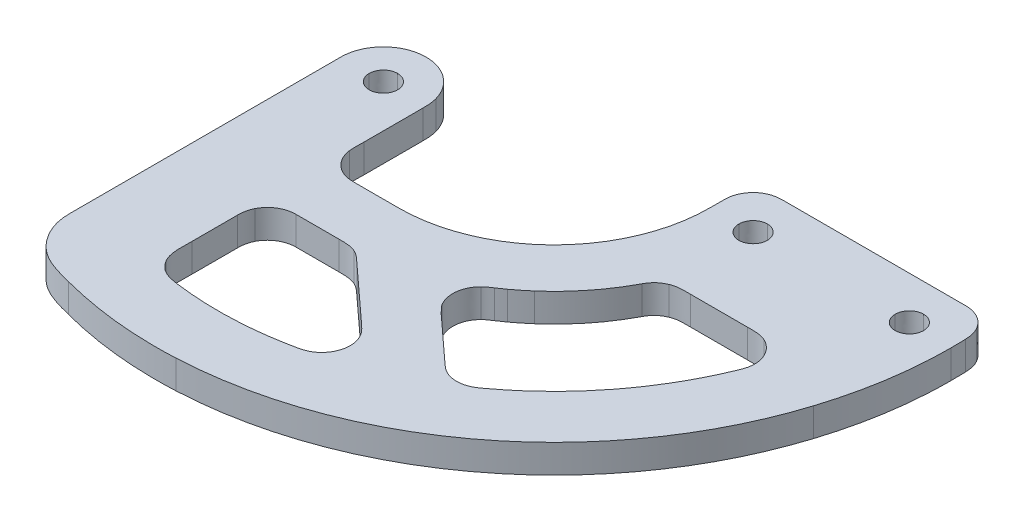
from build123d import *

# Parameters (mm, degrees)
BOSS_EXTRUDE1_DEPTH = 6.35


with BuildPart() as part:
    # Imported Profile → Boss-Extrude1 (new body)
    with BuildSketch(Plane(origin=(0, 0, 0), x_dir=(1, 0, 0), z_dir=(0, 1, 0))):
        with BuildLine():
            add(Edge.make_bspline(
                [(0.2385822, 77.0120888), (0.1971548, 76.9636002), (0.2384552, 77.0755888), (0.2384552, 77.1101074)],
                knots=[0, 0, 0, 0, 1, 1, 1, 1], degree=3))
            add(Edge.make_bspline(
                [(0.2384552, 77.1101074), (0.2384552, 77.1451086), (0.2384552, 77.1721088), (0.2384552, 77.206602)],
                knots=[0, 0, 0, 0, 1, 1, 1, 1], degree=3))
            add(Edge.make_bspline(
                [(0.2384552, 77.206602), (0.2384552, 77.2686034), (0.2384552, 77.3375898), (0.245491, 77.3995912)],
                knots=[0, 0, 0, 0, 1, 1, 1, 1], degree=3))
            add(Edge.make_bspline(
                [(0.245491, 77.3995912), (0.245491, 77.5306044), (0.259588, 77.6615922), (0.2661412, 77.7926054)],
                knots=[0, 0, 0, 0, 1, 1, 1, 1], degree=3))
            add(Edge.make_bspline(
                [(0.2661412, 77.7926054), (0.2936494, 78.0611088), (0.321183, 78.3231352), (0.3695192, 78.5850092)],
                knots=[0, 0, 0, 0, 1, 1, 1, 1], degree=3))
            add(Edge.make_bspline(
                [(0.3695192, 78.5850092), (0.459105, 79.1361892), (0.5969, 79.6736024), (0.7829296, 80.1972996)],
                knots=[0, 0, 0, 0, 1, 1, 1, 1], degree=3))
            add(Edge.make_bspline(
                [(0.7829296, 80.1972996), (1.1894566, 81.3341528), (1.7475454, 82.305652), (2.5330404, 83.2152006)],
                knots=[0, 0, 0, 0, 1, 1, 1, 1], degree=3))
            add(Edge.make_bspline(
                [(2.5330404, 83.2152006), (4.0557704, 84.992845), (6.1779404, 86.1434904), (8.4930488, 86.4535482)],
                knots=[0, 0, 0, 0, 1, 1, 1, 1], degree=3))
            add(Edge.make_bspline(
                [(8.4930488, 86.4535482), (13.2059426, 87.087456), (17.6501298, 84.1660496), (18.9316868, 79.584042)],
                knots=[0, 0, 0, 0, 1, 1, 1, 1], degree=3))
            add(Edge.make_bspline(
                [(18.9316868, 79.584042), (19.2279778, 78.5298404), (19.2899792, 77.4756388), (19.2899792, 76.3869948)],
                knots=[0, 0, 0, 0, 1, 1, 1, 1], degree=3))
            add(Edge.make_bspline(
                [(19.2899792, 76.3869948), (19.2899792, 75.2845586), (19.2899792, 74.1821478), (19.2899792, 73.0796862)],
                knots=[0, 0, 0, 0, 1, 1, 1, 1], degree=3))
            add(Edge.make_bspline(
                [(19.2899792, 73.0796862), (19.2899792, 70.8748392), (19.2899792, 68.6631088), (19.2899792, 66.4582364)],
                knots=[0, 0, 0, 0, 1, 1, 1, 1], degree=3))
            add(Edge.make_bspline(
                [(19.2899792, 66.4582364), (19.2899792, 65.3558002), (19.2899792, 64.2533894), (19.2899792, 63.1509532)],
                knots=[0, 0, 0, 0, 1, 1, 1, 1], degree=3))
            add(Edge.make_bspline(
                [(19.2899792, 63.1509532), (19.2899792, 62.0623092), (19.2003934, 60.9736398), (19.3312796, 59.8849958)],
                knots=[0, 0, 0, 0, 1, 1, 1, 1], degree=3))
            add(Edge.make_bspline(
                [(19.3312796, 59.8849958), (19.600037, 57.5216528), (21.1709762, 55.5096934), (23.3964988, 54.6691058)],
                knots=[0, 0, 0, 0, 1, 1, 1, 1], degree=3))
            add(Edge.make_bspline(
                [(23.3964988, 54.6691058), (24.4575838, 54.2695892), (25.4980186, 54.2626042), (26.593546, 54.2626042)],
                knots=[0, 0, 0, 0, 1, 1, 1, 1], degree=3))
            add(Edge.make_bspline(
                [(26.593546, 54.2626042), (27.6890988, 54.2626042), (28.7846516, 54.2626042), (29.880179, 54.2626042)],
                knots=[0, 0, 0, 0, 1, 1, 1, 1], degree=3))
            add(Edge.make_bspline(
                [(29.880179, 54.2626042), (32.0505836, 54.2626042), (34.2210136, 54.227603), (36.3914182, 54.267608)],
                knots=[0, 0, 0, 0, 1, 1, 1, 1], degree=3))
            add(Edge.make_bspline(
                [(36.3914182, 54.267608), (40.8493722, 54.3501072), (44.9352416, 55.197756), (49.0555788, 56.8927488)],
                knots=[0, 0, 0, 0, 1, 1, 1, 1], degree=3))
            add(Edge.make_bspline(
                [(49.0555788, 56.8927488), (57.8198996, 60.5032572), (64.7376658, 67.5174418), (68.2309786, 76.336906)],
                knots=[0, 0, 0, 0, 1, 1, 1, 1], degree=3))
            add(Edge.make_bspline(
                [(68.2309786, 76.336906), (69.9052958, 80.5743372), (70.6769986, 84.7567012), (70.6769986, 89.3180078)],
                knots=[0, 0, 0, 0, 1, 1, 1, 1], degree=3))
            add(Edge.make_bspline(
                [(70.6769986, 89.3180078), (70.6769986, 90.4341854), (70.635495, 91.5503884), (70.690994, 92.6666422)],
                knots=[0, 0, 0, 0, 1, 1, 1, 1], degree=3))
            add(Edge.make_bspline(
                [(70.690994, 92.6666422), (70.7460612, 93.879289), (71.0768454, 94.878398), (71.752079, 95.8843396)],
                knots=[0, 0, 0, 0, 1, 1, 1, 1], degree=3))
            add(Edge.make_bspline(
                [(71.752079, 95.8843396), (72.4617804, 96.9523588), (73.3092768, 97.6620094), (74.4875066, 98.1787978)],
                knots=[0, 0, 0, 0, 1, 1, 1, 1], degree=3))
            add(Edge.make_bspline(
                [(74.4875066, 98.1787978), (75.5623584, 98.6473008), (76.6234434, 98.7093022), (77.760322, 98.7093022)],
                knots=[0, 0, 0, 0, 1, 1, 1, 1], degree=3))
            add(Edge.make_bspline(
                [(77.760322, 98.7093022), (86.7520236, 98.7093022), (95.7506086, 98.7093022), (104.7423356, 98.7093022)],
                knots=[0, 0, 0, 0, 1, 1, 1, 1], degree=3))
            add(Edge.make_bspline(
                [(104.7423356, 98.7093022), (109.2140564, 98.7093022), (113.6858026, 98.7093022), (118.1575234, 98.7093022)],
                knots=[0, 0, 0, 0, 1, 1, 1, 1], degree=3))
            add(Edge.make_bspline(
                [(118.1575234, 98.7093022), (120.569101, 98.7093022), (122.7119466, 97.54489), (123.8763842, 95.4020444)],
                knots=[0, 0, 0, 0, 1, 1, 1, 1], degree=3))
            add(Edge.make_bspline(
                [(123.8763842, 95.4020444), (124.4413818, 94.368493), (124.620528, 93.3418504), (124.6618792, 92.1980884)],
                knots=[0, 0, 0, 0, 1, 1, 1, 1], degree=3))
            add(Edge.make_bspline(
                [(124.6618792, 92.1980884), (124.6963724, 91.1025356), (124.716921, 90.0138916), (124.7098598, 88.9183388)],
                knots=[0, 0, 0, 0, 1, 1, 1, 1], degree=3))
            add(Edge.make_bspline(
                [(124.7098598, 88.9183388), (124.689362, 79.747491), (123.3318336, 71.0865482), (120.5688724, 62.342903)],
                knots=[0, 0, 0, 0, 1, 1, 1, 1], degree=3))
            add(Edge.make_bspline(
                [(120.5688724, 62.342903), (109.3447394, 26.8722094), (77.2295636, 2.136394), (40.077644, 0.3311398)],
                knots=[0, 0, 0, 0, 1, 1, 1, 1], degree=3))
            add(Edge.make_bspline(
                [(40.077644, 0.3311398), (30.913705, -0.1168654), (22.1907354, 0.7926578), (13.3161532, 3.1010352)],
                knots=[0, 0, 0, 0, 1, 1, 1, 1], degree=3))
            add(Edge.make_bspline(
                [(13.3161532, 3.1010352), (8.7686134, 4.2861484), (4.8549814, 5.2783486), (2.0920456, 9.8120962)],
                knots=[0, 0, 0, 0, 1, 1, 1, 1], degree=3))
            add(Edge.make_bspline(
                [(2.0920456, 9.8120962), (0.8449056, 11.8515384), (0.2661412, 13.8634978), (0.2385822, 16.2613086)],
                knots=[0, 0, 0, 0, 1, 1, 1, 1], degree=3))
            add(Edge.make_bspline(
                [(0.2385822, 16.2613086), (0.211074, 18.4868566), (0.2385822, 20.7192372), (0.2385822, 22.9516432)],
                knots=[0, 0, 0, 0, 1, 1, 1, 1], degree=3))
            add(Edge.make_bspline(
                [(0.2385822, 22.9516432), (0.2385822, 40.9695396), (0.2385822, 58.9942432), (0.2385822, 77.0120888)],
                knots=[0, 0, 0, 0, 1, 1, 1, 1], degree=3))
        make_face()
        with BuildLine():
            add(Edge.make_bspline(
                [(77.7944342, 66.8094422), (75.031473, 61.61405), (71.6001616, 57.2870076), (67.1766246, 53.4009346)],
                knots=[0, 0, 0, 0, 1, 1, 1, 1], degree=3))
            add(Edge.make_bspline(
                [(67.1766246, 53.4009346), (66.1086816, 52.4569944), (64.9924532, 51.5681468), (63.834899, 50.7206504)],
                knots=[0, 0, 0, 0, 1, 1, 1, 1], degree=3))
            add(Edge.make_bspline(
                [(63.834899, 50.7206504), (63.263018, 50.3001534), (62.6773448, 49.893855), (62.0848136, 49.5010948)],
                knots=[0, 0, 0, 0, 1, 1, 1, 1], degree=3))
            add(Edge.make_bspline(
                [(62.0848136, 49.5010948), (61.4922316, 49.108106), (60.8927916, 48.7431588), (60.3898208, 48.2333046)],
                knots=[0, 0, 0, 0, 1, 1, 1, 1], degree=3))
            add(Edge.make_bspline(
                [(60.3898208, 48.2333046), (58.2538586, 46.1042004), (57.909333, 42.7762416), (59.5629746, 40.2613368)],
                knots=[0, 0, 0, 0, 1, 1, 1, 1], degree=3))
            add(Edge.make_bspline(
                [(59.5629746, 40.2613368), (60.1486478, 39.3656058), (61.8298484, 37.911786), (62.5877844, 37.2227348)],
                knots=[0, 0, 0, 0, 1, 1, 1, 1], degree=3))
            add(Edge.make_bspline(
                [(62.5877844, 37.2227348), (63.6488694, 36.2512356), (64.7099544, 35.2797364), (65.764156, 34.3081864)],
                knots=[0, 0, 0, 0, 1, 1, 1, 1], degree=3))
            add(Edge.make_bspline(
                [(65.764156, 34.3081864), (66.825241, 33.343596), (67.886326, 32.3720968), (68.9405276, 31.4005468)],
                knots=[0, 0, 0, 0, 1, 1, 1, 1], degree=3))
            add(Edge.make_bspline(
                [(68.9405276, 31.4005468), (69.4710828, 30.9180484), (70.001638, 30.4290476), (70.5321678, 29.9467524)],
                knots=[0, 0, 0, 0, 1, 1, 1, 1], degree=3))
            add(Edge.make_bspline(
                [(70.5321678, 29.9467524), (71.0489308, 29.464254), (71.5519016, 28.9613848), (72.1100158, 28.5273496)],
                knots=[0, 0, 0, 0, 1, 1, 1, 1], degree=3))
            add(Edge.make_bspline(
                [(72.1100158, 28.5273496), (73.3847148, 27.5420582), (74.6180372, 27.149298), (76.2234696, 27.2044414)],
                knots=[0, 0, 0, 0, 1, 1, 1, 1], degree=3))
            add(Edge.make_bspline(
                [(76.2234696, 27.2044414), (77.780642, 27.2664428), (78.9519884, 27.8452072), (80.1646606, 28.7409382)],
                knots=[0, 0, 0, 0, 1, 1, 1, 1], degree=3))
            add(Edge.make_bspline(
                [(80.1646606, 28.7409382), (82.4521846, 30.4221388), (84.629498, 32.2136008), (86.7172256, 34.1497412)],
                knots=[0, 0, 0, 0, 1, 1, 1, 1], degree=3))
            add(Edge.make_bspline(
                [(86.7172256, 34.1497412), (90.9684744, 38.0840488), (94.6478422, 42.36974), (97.893124, 47.1721942)],
                knots=[0, 0, 0, 0, 1, 1, 1, 1], degree=3))
            add(Edge.make_bspline(
                [(97.893124, 47.1721942), (99.5123232, 49.570005), (100.9799352, 52.0366498), (102.3166102, 54.59984)],
                knots=[0, 0, 0, 0, 1, 1, 1, 1], degree=3))
            add(Edge.make_bspline(
                [(102.3166102, 54.59984), (103.0538706, 56.0261008), (105.3827458, 60.800996), (105.7479216, 62.4201952)],
                knots=[0, 0, 0, 0, 1, 1, 1, 1], degree=3))
            add(Edge.make_bspline(
                [(105.7479216, 62.4201952), (106.4162972, 65.3485358), (104.9417764, 68.3388524), (102.220141, 69.5929012)],
                knots=[0, 0, 0, 0, 1, 1, 1, 1], degree=3))
            add(Edge.make_bspline(
                [(102.220141, 69.5929012), (100.828348, 70.2336416), (99.4572052, 70.178549), (98.0171522, 70.178549)],
                knots=[0, 0, 0, 0, 1, 1, 1, 1], degree=3))
            add(Edge.make_bspline(
                [(98.0171522, 70.178549), (96.5977494, 70.178549), (95.1714886, 70.178549), (93.7521112, 70.178549)],
                knots=[0, 0, 0, 0, 1, 1, 1, 1], degree=3))
            add(Edge.make_bspline(
                [(93.7521112, 70.178549), (90.8926808, 70.178549), (88.0401338, 70.178549), (85.1876122, 70.178549)],
                knots=[0, 0, 0, 0, 1, 1, 1, 1], degree=3))
            add(Edge.make_bspline(
                [(85.1876122, 70.178549), (83.7475592, 70.178549), (82.3626242, 70.2750436), (80.9570136, 69.6895482)],
                knots=[0, 0, 0, 0, 1, 1, 1, 1], degree=3))
            add(Edge.make_bspline(
                [(80.9570136, 69.6895482), (79.4963104, 69.0762906), (78.538578, 68.208144), (77.7944342, 66.8094422)],
                knots=[0, 0, 0, 0, 1, 1, 1, 1], degree=3))
        make_face(mode=Mode.SUBTRACT)
        with BuildLine():
            add(Edge.make_bspline(
                [(25.6356866, 41.5635948), (27.7923244, 41.5635948), (29.9489622, 41.5635948), (32.0986912, 41.5635948)],
                knots=[0, 0, 0, 0, 1, 1, 1, 1], degree=3))
            add(Edge.make_bspline(
                [(32.0986912, 41.5635948), (33.173543, 41.5635948), (34.2553036, 41.5635948), (35.3301808, 41.5635948)],
                knots=[0, 0, 0, 0, 1, 1, 1, 1], degree=3))
            add(Edge.make_bspline(
                [(35.3301808, 41.5635948), (36.6668812, 41.5635948), (37.9346714, 41.5786062), (39.2231372, 40.9916884)],
                knots=[0, 0, 0, 0, 1, 1, 1, 1], degree=3))
            add(Edge.make_bspline(
                [(39.2231372, 40.9916884), (40.2980144, 40.4957026), (41.0835094, 39.703248), (41.924097, 38.9246364)],
                knots=[0, 0, 0, 0, 1, 1, 1, 1], degree=3))
            add(Edge.make_bspline(
                [(41.924097, 38.9246364), (42.7646846, 38.1598424), (43.6052976, 37.3881396), (44.4459106, 36.6164368)],
                knots=[0, 0, 0, 0, 1, 1, 1, 1], degree=3))
            add(Edge.make_bspline(
                [(44.4459106, 36.6164368), (46.1271112, 35.0798892), (47.8083372, 33.5433924), (49.4895124, 31.9999868)],
                knots=[0, 0, 0, 0, 1, 1, 1, 1], degree=3))
            add(Edge.make_bspline(
                [(49.4895124, 31.9999868), (51.1500628, 30.4773076), (52.8174966, 28.9476434), (54.484905, 27.424888)],
                knots=[0, 0, 0, 0, 1, 1, 1, 1], degree=3))
            add(Edge.make_bspline(
                [(54.484905, 27.424888), (55.3324014, 26.6463018), (56.1041042, 25.874599), (56.5864248, 24.7860058)],
                knots=[0, 0, 0, 0, 1, 1, 1, 1], degree=3))
            add(Edge.make_bspline(
                [(56.5864248, 24.7860058), (57.0893956, 23.662894), (57.2409828, 22.601809), (57.0893956, 21.3822026)],
                knots=[0, 0, 0, 0, 1, 1, 1, 1], degree=3))
            add(Edge.make_bspline(
                [(57.0893956, 21.3822026), (56.7862466, 19.046444), (55.2152566, 17.0689524), (53.0104096, 16.2489896)],
                knots=[0, 0, 0, 0, 1, 1, 1, 1], degree=3))
            add(Edge.make_bspline(
                [(53.0104096, 16.2489896), (51.790854, 15.787497), (47.6222822, 15.1121364), (46.3613754, 14.9329902)],
                knots=[0, 0, 0, 0, 1, 1, 1, 1], degree=3))
            add(Edge.make_bspline(
                [(46.3613754, 14.9329902), (41.8207444, 14.2852902), (37.3145558, 14.0579348), (32.7394824, 14.2371064)],
                knots=[0, 0, 0, 0, 1, 1, 1, 1], degree=3))
            add(Edge.make_bspline(
                [(32.7394824, 14.2371064), (30.479492, 14.3265906), (28.2401772, 14.5196052), (26.0008624, 14.8158454)],
                knots=[0, 0, 0, 0, 1, 1, 1, 1], degree=3))
            add(Edge.make_bspline(
                [(26.0008624, 14.8158454), (23.5203746, 15.1398478), (21.618702, 15.6358082), (20.1924412, 18.0060346)],
                knots=[0, 0, 0, 0, 1, 1, 1, 1], degree=3))
            add(Edge.make_bspline(
                [(20.1924412, 18.0060346), (18.9728602, 20.0386442), (19.2898268, 22.6086416), (19.2898268, 24.6894858)],
                knots=[0, 0, 0, 0, 1, 1, 1, 1], degree=3))
            add(Edge.make_bspline(
                [(19.2898268, 24.6894858), (19.2898268, 26.963243), (19.2898268, 29.237051), (19.2898268, 31.5108082)],
                knots=[0, 0, 0, 0, 1, 1, 1, 1], degree=3))
            add(Edge.make_bspline(
                [(19.2898268, 31.5108082), (19.2898268, 32.6269858), (19.2898268, 33.7431888), (19.2898268, 34.8663514)],
                knots=[0, 0, 0, 0, 1, 1, 1, 1], degree=3))
            add(Edge.make_bspline(
                [(19.2898268, 34.8663514), (19.2898268, 36.0169968), (19.4482212, 37.0504974), (19.9788272, 38.104699)],
                knots=[0, 0, 0, 0, 1, 1, 1, 1], degree=3))
            add(Edge.make_bspline(
                [(19.9788272, 38.104699), (21.0674966, 40.2268944), (23.251668, 41.5635948), (25.6356866, 41.5635948)],
                knots=[0, 0, 0, 0, 1, 1, 1, 1], degree=3))
        make_face(mode=Mode.SUBTRACT)
        with BuildLine():
            add(Edge.make_bspline(
                [(83.382358, 89.1885948), (83.382358, 90.9387056), (81.9560972, 92.3649918), (80.2059864, 92.3649918)],
                knots=[0, 0, 0, 0, 1, 1, 1, 1], degree=3))
            add(Edge.make_bspline(
                [(80.2059864, 92.3649918), (78.455901, 92.3649918), (77.0296148, 90.9387056), (77.0296148, 89.1885948)],
                knots=[0, 0, 0, 0, 1, 1, 1, 1], degree=3))
            add(Edge.make_bspline(
                [(77.0296148, 89.1885948), (77.0296148, 87.4316006), (78.455901, 86.0121978), (80.2059864, 86.0121978)],
                knots=[0, 0, 0, 0, 1, 1, 1, 1], degree=3))
            add(Edge.make_bspline(
                [(80.2059864, 86.0121978), (81.9560972, 86.0121978), (83.382358, 87.4316006), (83.382358, 89.1885948)],
                knots=[0, 0, 0, 0, 1, 1, 1, 1], degree=3))
        make_face(mode=Mode.SUBTRACT)
        with BuildLine():
            add(Edge.make_bspline(
                [(12.9370582, 77.0135874), (12.9370582, 78.770607), (11.5176808, 80.1899844), (9.7606866, 80.1899844)],
                knots=[0, 0, 0, 0, 1, 1, 1, 1], degree=3))
            add(Edge.make_bspline(
                [(9.7606866, 80.1899844), (8.0105758, 80.1899844), (6.5842896, 78.770607), (6.5842896, 77.0135874)],
                knots=[0, 0, 0, 0, 1, 1, 1, 1], degree=3))
            add(Edge.make_bspline(
                [(6.5842896, 77.0135874), (6.5842896, 75.263502), (8.0105758, 73.8372412), (9.7606866, 73.8372412)],
                knots=[0, 0, 0, 0, 1, 1, 1, 1], degree=3))
            add(Edge.make_bspline(
                [(9.7606866, 73.8372412), (11.5176808, 73.8372412), (12.9370582, 75.263502), (12.9370582, 77.0135874)],
                knots=[0, 0, 0, 0, 1, 1, 1, 1], degree=3))
        make_face(mode=Mode.SUBTRACT)
        with BuildLine():
            add(Edge.make_bspline(
                [(118.3018716, 89.1885948), (118.3018716, 90.9387056), (116.8824942, 92.3649918), (115.132358, 92.3649918)],
                knots=[0, 0, 0, 0, 1, 1, 1, 1], degree=3))
            add(Edge.make_bspline(
                [(115.132358, 92.3649918), (113.3753892, 92.3649918), (111.9559864, 90.9387056), (111.9559864, 89.1885948)],
                knots=[0, 0, 0, 0, 1, 1, 1, 1], degree=3))
            add(Edge.make_bspline(
                [(111.9559864, 89.1885948), (111.9559864, 87.4316006), (113.3753892, 86.0121978), (115.132358, 86.0121978)],
                knots=[0, 0, 0, 0, 1, 1, 1, 1], degree=3))
            add(Edge.make_bspline(
                [(115.132358, 86.0121978), (116.8824942, 86.0121978), (118.3018716, 87.4316006), (118.3018716, 89.1885948)],
                knots=[0, 0, 0, 0, 1, 1, 1, 1], degree=3))
        make_face(mode=Mode.SUBTRACT)
    extrude(amount=BOSS_EXTRUDE1_DEPTH)


solid = part.part
